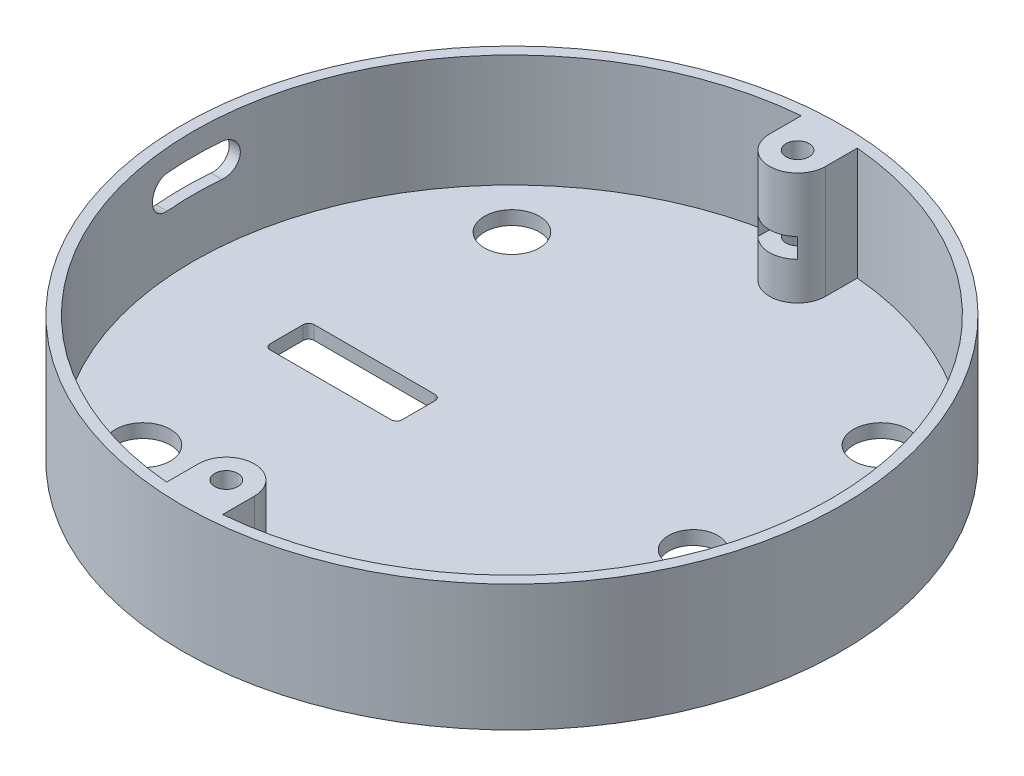
from build123d import *

# Parameters (mm, degrees)
SKETCH1_R               = 60
BOSS_EXTRUDE1_DEPTH     = 2.5
SKETCH2_R               = 60
SKETCH2_R_2             = 58
BOSS_EXTRUDE2_DEPTH     = 20.5
SKETCH3_R               = 4.5
SKETCH3_R_2             = 5
CUT_EXTRUDE1_DEPTH      = 88.294043325
SKETCH4_W               = 24
SKETCH4_H               = 8
CUT_EXTRUDE2_DEPTH      = 88.294043325
FILLET1_R               = 1
SKETCH5_R               = 2.1
BOSS_EXTRUDE3_DEPTH     = 20.5
CUT_EXTRUDE3_START      = -3.6
CUT_EXTRUDE3_DEPTH      = 3.6
CUT_EXTRUDE4_REACH      = 138.121
CUT_EXTRUDE4_END_RADIUS = 58


with BuildPart() as part:
    # Sketch1 → Boss-Extrude1 (new body)
    with BuildSketch(Plane(origin=(0, 0, 0), x_dir=(1, 0, 0), z_dir=(0, 1, 0))):
        with Locations(Location((0, 0, 0), (0, 0, 270))):
            Circle(SKETCH1_R)
    extrude(amount=BOSS_EXTRUDE1_DEPTH)

    # Sketch2 → Boss-Extrude2 (add)
    with BuildSketch(Plane(origin=(0, 2.5, 0), x_dir=(1, 0, 0), z_dir=(0, 1, 0))):
        with Locations(Location((0, 0, 0), (0, 0, 270))):
            Circle(SKETCH2_R)
        with Locations(Location((0, 0, 0), (0, 0, 270))):
            Circle(SKETCH2_R_2, mode=Mode.SUBTRACT)
    extrude(amount=BOSS_EXTRUDE2_DEPTH)

    # Sketch3 → Cut-Extrude1 (cut, through all)
    with BuildSketch(Plane(origin=(0, 2.5, 0), x_dir=(1, 0, 0), z_dir=(0, 1, 0))):
        with Locations(Location((33, 0, 0), (0, 0, 270))):
            Circle(SKETCH3_R)
        with Locations(Location((33.587572106, 33.587572106, 0), (0, 0, 270))):
            Circle(SKETCH3_R_2)
        with Locations(Location((33.587572106, -33.587572106, 0), (0, 0, 270))):
            Circle(SKETCH3_R_2)
        with Locations(Location((-33.587572106, -33.587572106, 0), (0, 0, 270))):
            Circle(SKETCH3_R_2)
        with Locations(Location((-33.587572106, 33.587572106, 0), (0, 0, 270))):
            Circle(SKETCH3_R_2)
    extrude(amount=-CUT_EXTRUDE1_DEPTH, mode=Mode.SUBTRACT)

    # Sketch4 → Cut-Extrude2 (cut, through all)
    with BuildSketch(Plane(origin=(0, 2.5, 0), x_dir=(1, 0, 0), z_dir=(0, 1, 0))):
        with Locations((-26, -3)):
            Rectangle(SKETCH4_W, SKETCH4_H)
    extrude(amount=-CUT_EXTRUDE2_DEPTH, mode=Mode.SUBTRACT)

    # Fillet1
    fillet1_edges = [part.edges().sort_by_distance(p)[0] for p in [
        (-38, 1.25, 7),
        (-38, 1.25, -1),
        (-14, 1.25, -1),
        (-14, 1.25, 7),
    ]]
    fillet(fillet1_edges, radius=FILLET1_R)

    # Sketch5 → Boss-Extrude3 (add, through all)
    # profile 1 of 2: a face of its own
    with BuildSketch(Plane(origin=(0, 2.5, 0), x_dir=(1, 0, 0), z_dir=(0, 1, 0))):
        with BuildLine():
            Line((-5.1, 52), (-5.1, 57.775340761))
            ThreePointArc((-5.1, 57.775340761), (0, 58), (5.1, 57.775340761))
            Line((5.1, 57.775340761), (5.1, 52))
            ThreePointArc((5.1, 52), (0, 46.9), (-5.1, 52))
        make_face()
        with Locations(Location((0, 52, 0), (0, 0, 270))):
            Circle(SKETCH5_R, mode=Mode.SUBTRACT)
    # profile 2 of 2: a face of its own
    with BuildSketch(Plane(origin=(0, 2.5, 0), x_dir=(1, 0, 0), z_dir=(0, 1, 0))):
        with BuildLine():
            Line((5.1, -52), (5.1, -57.775340761))
            ThreePointArc((5.1, -57.775340761), (0, -58), (-5.1, -57.775340761))
            Line((-5.1, -57.775340761), (-5.1, -52))
            ThreePointArc((-5.1, -52), (0, -46.9), (5.1, -52))
        make_face()
        with Locations(Location((0, -52, 0), (0, 0, 90))):
            Circle(SKETCH5_R, mode=Mode.SUBTRACT)
    extrude(amount=BOSS_EXTRUDE3_DEPTH)

    # Sketch6 → Cut-Extrude3 (cut)
    with BuildSketch(Plane(origin=(0, 13, 0), x_dir=(1, 0, 0), z_dir=(0, 1, 0)).offset(CUT_EXTRUDE3_START)):
        with BuildLine():
            Line((3.6, 54.078460969), (0, 56.156921938))
            Line((0, 56.156921938), (-3.6, 54.078460969))
            Line((-3.6, 54.078460969), (-3.6, 48.387521626))
            ThreePointArc((-3.6, 48.387521626), (0, 46.9), (3.6, 48.387521626))
            Line((3.6, 48.387521626), (3.6, 54.078460969))
        make_face()
        with BuildLine():
            Line((3.6, -48.387521626), (3.6, -54.078460969))
            Line((3.6, -54.078460969), (0, -56.156921938))
            Line((0, -56.156921938), (-3.6, -54.078460969))
            Line((-3.6, -54.078460969), (-3.6, -48.387521626))
            ThreePointArc((-3.6, -48.387521626), (0, -46.9), (3.6, -48.387521626))
        make_face()
    extrude(amount=CUT_EXTRUDE3_DEPTH, mode=Mode.SUBTRACT)

    # Cut-Extrude4: up to this cylinder (the profile starts outside it)
    cut_extrude4_end = Plane(origin=(0, 16, 0), z_dir=(0, -1, 0)) * Cylinder(CUT_EXTRUDE4_END_RADIUS, 393.242, mode=Mode.PRIVATE)
    # Sketch7 → Cut-Extrude4 (cut, up to the surface)
    with BuildSketch(Plane.ZY.offset(60), mode=Mode.PRIVATE) as cut_extrude4_sk1:
        with BuildLine():
            Line((-5, 19), (5, 19))
            ThreePointArc((5, 19), (8, 16), (5, 13))
            Line((5, 13), (-5, 13))
            ThreePointArc((-5, 13), (-8, 16), (-5, 19))
        make_face()
    cut_extrude4_tool1 = extrude(cut_extrude4_sk1.sketch, amount=-CUT_EXTRUDE4_REACH, mode=Mode.PRIVATE) - cut_extrude4_end
    add(cut_extrude4_tool1.solids().sort_by_distance((-60, 16, 0))[0], mode=Mode.SUBTRACT)


solid = part.part
